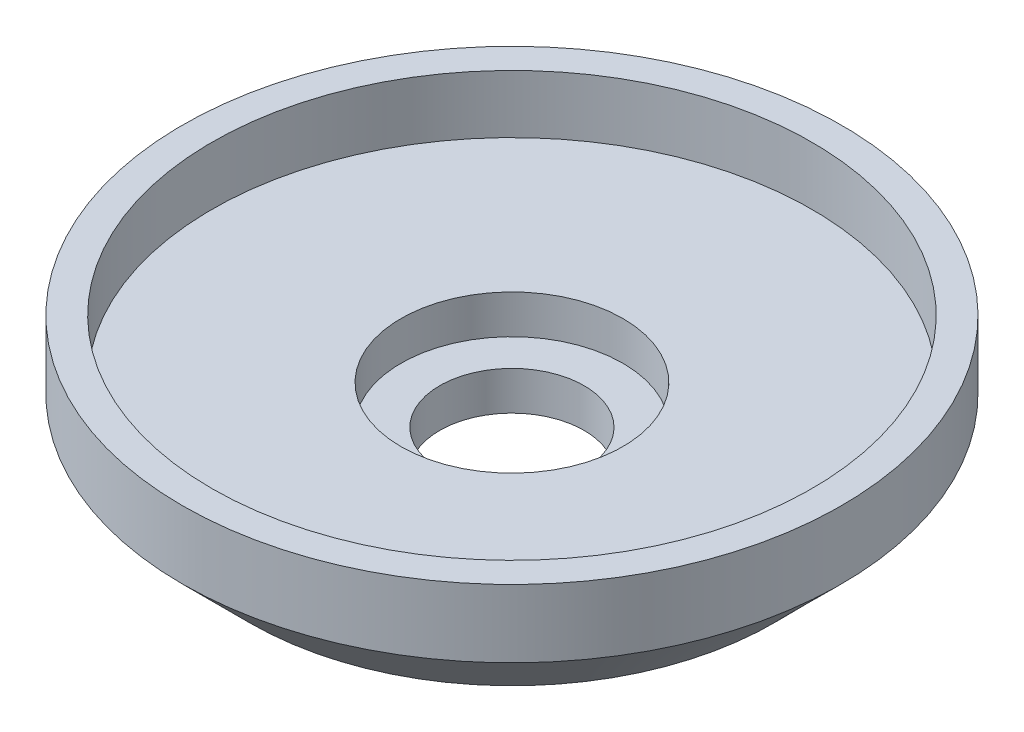
from build123d import *

# Parameters (mm, degrees)
SKETCH1_R           = 34
BOSS_EXTRUDE1_DEPTH = 14
SKETCH2_R           = 30.95
CUT_EXTRUDE1_DEPTH  = 6
SKETCH3_R           = 11.45
CUT_EXTRUDE2_DEPTH  = 4
SKETCH4_R           = 7.45
CUT_EXTRUDE3_DEPTH  = 4
CHAMFER1_SIZE       = 7


with BuildPart() as part:
    # Sketch1 → Boss-Extrude1 (new body)
    with BuildSketch(Plane(origin=(0, 0, 0), x_dir=(1, 0, 0), z_dir=(0, 1, 0))):
        with Locations(Location((0, 0, 0), (0, 0, 270))):
            Circle(SKETCH1_R)
    extrude(amount=BOSS_EXTRUDE1_DEPTH)

    # Sketch2 → Cut-Extrude1 (cut)
    with BuildSketch(Plane(origin=(0, 14, 0), x_dir=(1, 0, 0), z_dir=(0, 1, 0))):
        with Locations(Location((0, 0, 0), (0, 0, 270))):
            Circle(SKETCH2_R)
    extrude(amount=-CUT_EXTRUDE1_DEPTH, mode=Mode.SUBTRACT)

    # Sketch3 → Cut-Extrude2 (cut)
    with BuildSketch(Plane(origin=(0, 8, 0), x_dir=(1, 0, 0), z_dir=(0, 1, 0))):
        with Locations(Location((0, 0, 0), (0, 0, 270))):
            Circle(SKETCH3_R)
    extrude(amount=-CUT_EXTRUDE2_DEPTH, mode=Mode.SUBTRACT)

    # Sketch4 → Cut-Extrude3 (cut)
    with BuildSketch(Plane(origin=(0, 4, 0), x_dir=(1, 0, 0), z_dir=(0, 1, 0))):
        with Locations(Location((0, 0, 0), (0, 0, 270))):
            Circle(SKETCH4_R)
    extrude(amount=-CUT_EXTRUDE3_DEPTH, mode=Mode.SUBTRACT)

    # Chamfer1
    chamfer1_edges = [part.edges().sort_by_distance(p)[0] for p in [
        (0, 0, -34),
    ]]
    chamfer(chamfer1_edges, length=CHAMFER1_SIZE)


solid = part.part
